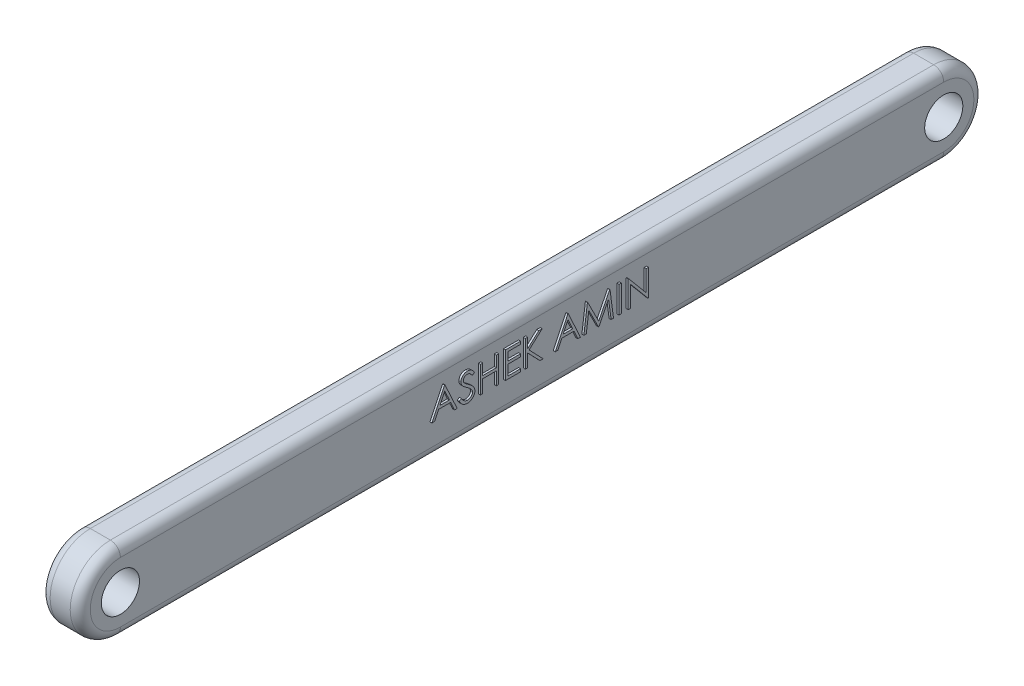
from build123d import *

# Parameters (mm, degrees)
SKETCH1_R           = 0.95
BOSS_EXTRUDE1_DEPTH = 1
FILLET1_R           = 0.5
SKETCH3_W           = 0.11872329
SKETCH3_H           = 1.322916667
BOSS_EXTRUDE3_DEPTH = 0.1


with BuildPart() as part:
    # Sketch1 → Boss-Extrude1 (new, symmetric)
    with BuildSketch(Plane(origin=(0, 0, 0), x_dir=(0, 0, -1), z_dir=(1, 0, 0))):
        with BuildLine():
            Line((-20.5, 2), (20.5, 2))
            ThreePointArc((20.5, 2), (22.5, 0), (20.5, -2))
            Line((20.5, -2), (-20.5, -2))
            ThreePointArc((-20.5, -2), (-22.5, 0), (-20.5, 2))
        make_face()
        with Locations((20.5, 0)):
            Circle(SKETCH1_R, mode=Mode.SUBTRACT)
        with Locations((-20.5, 0)):
            Circle(SKETCH1_R, mode=Mode.SUBTRACT)
    extrude(amount=BOSS_EXTRUDE1_DEPTH, both=True)

    # Fillet1
    fillet1_edges = [part.edges().sort_by_distance(p)[0] for p in [
        (1, 0, -22.5),
        (1, 2, 0),
        (1, 0, 22.5),
        (-1, 2, 0),
        (-1, 0, -22.5),
        (-1, -2, 0),
        (-1, 0, 22.5),
        (1, -2, 0),
    ]]
    fillet(fillet1_edges, radius=FILLET1_R)

    # Sketch3 → Boss-Extrude3 (add)
    # profile 1 of 9: a face of its own
    with BuildSketch(Plane(origin=(1, 0, 0), x_dir=(0, 0, -1), z_dir=(1, 0, 0))):
        Polygon((-4.439999829, 0.966036267), (-3.829422906, -0.3568804), (-3.958481483, -0.3568804), (-4.154056904, 0.067131352), (-4.753768526, 0.067131352), (-4.954909101, -0.3568804), (-5.084497692, -0.3568804), (-4.456960299, 0.966036267), align=None)
        Polygon((-4.449805101, 0.70818412), (-4.689371741, 0.202815113), (-4.216598637, 0.202815113), align=None, mode=Mode.SUBTRACT)
    # profile 2 of 9: a face of its own
    with BuildSketch(Plane(origin=(1, 0, 0), x_dir=(0, 0, -1), z_dir=(1, 0, 0))):
        with BuildLine():
            Line((-3.727660086, -0.101678326), (-3.615826986, -0.034631468))
            add(Edge.make_bspline(
                [(-3.615826986, -0.034631468), (-3.605425747, -0.052042709), (-3.585497376, -0.085401974), (-3.552253856, -0.130478674), (-3.517807786, -0.168791156), (-3.481904079, -0.20011654), (-3.44476189, -0.224779066), (-3.406138751, -0.24224241), (-3.366164817, -0.253134162), (-3.338960426, -0.254457112), (-3.325378936, -0.255117579)],
                knots=[0, 0, 0, 0, 1.272034388, 2.437168799, 3.508375237, 4.49857839, 5.41946034, 6.295179144, 7.148887113, 8, 8, 8, 8], degree=3))
            add(Edge.make_bspline(
                [(-3.325378936, -0.255117579), (-3.313780033, -0.254794533), (-3.290785181, -0.254154094), (-3.256932786, -0.248000339), (-3.224055736, -0.23854635), (-3.192831637, -0.22500689), (-3.163691331, -0.208625975), (-3.13813761, -0.188840366), (-3.11604637, -0.166688615), (-3.097975663, -0.141975529), (-3.084111483, -0.115397321), (-3.073455553, -0.08811653), (-3.067542087, -0.059704601), (-3.066651291, -0.040575051), (-3.066201752, -0.030921365)],
                knots=[0, 0, 0, 0, 1.095163259, 2.171163733, 3.241058638, 4.321873601, 5.38011039, 6.391990106, 7.366004449, 8.327778327, 9.272591725, 10.192022065, 11.087607919, 12, 12, 12, 12], degree=3))
            add(Edge.make_bspline(
                [(-3.066201752, -0.030921365), (-3.066759007, -0.019906818), (-3.067891823, 0.002484147), (-3.07746652, 0.035519135), (-3.092528586, 0.068211267), (-3.10642399, 0.088433472), (-3.113638067, 0.098932234)],
                knots=[0, 0, 0, 0, 0.938893495, 1.908633276, 2.914225137, 4, 4, 4, 4], degree=3))
            add(Edge.make_bspline(
                [(-3.113638067, 0.098932234), (-3.119561186, 0.106509456), (-3.131996034, 0.122416886), (-3.153373427, 0.146095293), (-3.178458238, 0.170519517), (-3.206392022, 0.196622196), (-3.238192326, 0.22318931), (-3.272863143, 0.251487736), (-3.311289661, 0.280441309), (-3.338239173, 0.299858915), (-3.352144678, 0.30987808)],
                knots=[0, 0, 0, 0, 0.722233717, 1.516239348, 2.393582979, 3.351407094, 4.387010283, 5.505090956, 6.712668013, 8, 8, 8, 8], degree=3))
            add(Edge.make_bspline(
                [(-3.352144678, 0.30987808), (-3.366063271, 0.319791862), (-3.392674563, 0.338746258), (-3.429889563, 0.366876865), (-3.463168273, 0.392595828), (-3.492362783, 0.416145261), (-3.517460249, 0.437528358), (-3.538658443, 0.456539782), (-3.555417362, 0.473693687), (-3.564736585, 0.484821813), (-3.568920686, 0.489818068)],
                knots=[0, 0, 0, 0, 1.452282411, 2.77665338, 3.964542531, 5.026858415, 5.96415736, 6.766646006, 7.446254459, 8, 8, 8, 8], degree=3))
            add(Edge.make_bspline(
                [(-3.568920686, 0.489818068), (-3.57476894, 0.497604769), (-3.586270315, 0.512918363), (-3.601452109, 0.536853651), (-3.6143559, 0.561355302), (-3.624471424, 0.586489156), (-3.632989578, 0.611902358), (-3.638718915, 0.637926489), (-3.642306437, 0.664444777), (-3.642673825, 0.682290356), (-3.642857735, 0.69122365)],
                knots=[0, 0, 0, 0, 1.068054152, 2.10047183, 3.106115577, 4.101338837, 5.06977816, 6.043150881, 7.020423561, 8, 8, 8, 8], degree=3))
            add(Edge.make_bspline(
                [(-3.642857735, 0.69122365), (-3.642364397, 0.705220023), (-3.641388266, 0.732913607), (-3.633133071, 0.773368712), (-3.620103138, 0.811992745), (-3.60184882, 0.848403318), (-3.578317023, 0.881652364), (-3.55108536, 0.912122343), (-3.518650661, 0.937737253), (-3.483063211, 0.960118001), (-3.444110356, 0.977635658), (-3.403292366, 0.990850076), (-3.360544366, 0.998337504), (-3.331590205, 0.999412001), (-3.316898701, 0.999957207)],
                knots=[0, 0, 0, 0, 1.005424448, 1.989358655, 2.955360095, 3.929531133, 4.905563448, 5.876582895, 6.856512386, 7.866279853, 8.892233794, 9.918561126, 10.94386622, 12, 12, 12, 12], degree=3))
            add(Edge.make_bspline(
                [(-3.316898701, 0.999957207), (-3.301309413, 0.999419516), (-3.270307295, 0.998350221), (-3.224704764, 0.98905294), (-3.180798779, 0.973669055), (-3.145479449, 0.956210842), (-3.117837007, 0.938774266), (-3.096756242, 0.922891772), (-3.075393991, 0.904607133), (-3.053577941, 0.883871644), (-3.031677751, 0.860495045), (-3.009368291, 0.834637433), (-2.986597392, 0.80645683), (-2.9719486, 0.786339236), (-2.964438932, 0.776026)],
                knots=[0, 0, 0, 0, 1.286793592, 2.559021753, 3.825965368, 5.121522368, 5.803751409, 6.523245864, 7.299691795, 8.125521123, 9.008227632, 9.944561021, 10.946284179, 12, 12, 12, 12], degree=3))
            Line((-2.964438932, 0.776026), (-3.071766906, 0.694668745))
            add(Edge.make_bspline(
                [(-3.071766906, 0.694668745), (-3.078247661, 0.703017745), (-3.090728078, 0.719095965), (-3.109675831, 0.741612504), (-3.127534695, 0.762180637), (-3.145129637, 0.78004573), (-3.161531397, 0.79618612), (-3.177450636, 0.810004838), (-3.192658263, 0.82163728), (-3.211828047, 0.834051364), (-3.235911828, 0.846356947), (-3.266144078, 0.856769842), (-3.2977377, 0.863027262), (-3.319255745, 0.863854609), (-3.330149068, 0.864273446)],
                knots=[0, 0, 0, 0, 1.181633172, 2.275549214, 3.290209073, 4.226197932, 5.078386478, 5.862611352, 6.581680152, 7.217281963, 8.414376989, 9.595101626, 10.782541182, 12, 12, 12, 12], degree=3))
            add(Edge.make_bspline(
                [(-3.330149068, 0.864273446), (-3.343815372, 0.863815453), (-3.370169554, 0.862932255), (-3.407585506, 0.853286308), (-3.441260888, 0.838098522), (-3.470195935, 0.816812801), (-3.494286995, 0.791593854), (-3.511713761, 0.762573275), (-3.522202662, 0.730527545), (-3.523482595, 0.708173407), (-3.524134444, 0.696788804)],
                knots=[0, 0, 0, 0, 1.14458467, 2.207223713, 3.21896685, 4.227309161, 5.202851033, 6.127160689, 7.046193047, 8, 8, 8, 8], degree=3))
            add(Edge.make_bspline(
                [(-3.524134444, 0.696788804), (-3.523985852, 0.689701192), (-3.523688424, 0.675514377), (-3.519540212, 0.65455506), (-3.514211001, 0.633648691), (-3.505766018, 0.612889262), (-3.494107228, 0.591913716), (-3.478797236, 0.570360857), (-3.459515419, 0.548040717), (-3.444745238, 0.533523644), (-3.436947028, 0.525859067)],
                knots=[0, 0, 0, 0, 0.858281714, 1.717966888, 2.583508476, 3.4729293, 4.427298488, 5.488583878, 6.674047936, 8, 8, 8, 8], degree=3))
            add(Edge.make_bspline(
                [(-3.436947028, 0.525859067), (-3.434051212, 0.523274834), (-3.427171415, 0.517135288), (-3.414593907, 0.507084039), (-3.397984576, 0.494685372), (-3.377777137, 0.479344333), (-3.353598997, 0.461548661), (-3.325447498, 0.441525897), (-3.293636442, 0.418626036), (-3.27106298, 0.402615894), (-3.259127099, 0.394150416)],
                knots=[0, 0, 0, 0, 0.420754252, 0.999615792, 1.744751191, 2.668019286, 3.750313428, 4.999500688, 6.413464383, 8, 8, 8, 8], degree=3))
            add(Edge.make_bspline(
                [(-3.259127099, 0.394150416), (-3.244769329, 0.38370264), (-3.216967495, 0.363471971), (-3.177409422, 0.333076758), (-3.141541822, 0.303349774), (-3.109238766, 0.274480857), (-3.080181125, 0.246688989), (-3.054691272, 0.219639811), (-3.032509482, 0.193527109), (-3.008629242, 0.160048784), (-2.984227923, 0.118932124), (-2.963272353, 0.068556124), (-2.95005893, 0.0179843), (-2.948331006, -0.016005903), (-2.947478462, -0.032776417)],
                knots=[0, 0, 0, 0, 1.163667725, 2.253281268, 3.268753668, 4.215851969, 5.092017293, 5.902905408, 6.650798638, 7.335211899, 8.59617414, 9.77448103, 10.901945474, 12, 12, 12, 12], degree=3))
            add(Edge.make_bspline(
                [(-2.947478462, -0.032776417), (-2.947726844, -0.044636692), (-2.948218786, -0.068126923), (-2.953873655, -0.102619169), (-2.962158767, -0.136119528), (-2.974646054, -0.168213907), (-2.989887248, -0.199489457), (-3.009226872, -0.229125776), (-3.031643764, -0.25777879), (-3.057358908, -0.284684455), (-3.085497686, -0.309383761), (-3.115238249, -0.331355162), (-3.146629275, -0.349675035), (-3.179500472, -0.364624311), (-3.213859391, -0.376316444), (-3.249694476, -0.384787975), (-3.287064797, -0.389987306), (-3.312464979, -0.390526966), (-3.325378936, -0.39080134)],
                knots=[0, 0, 0, 0, 0.983748083, 1.948392443, 2.894712957, 3.844097841, 4.80183111, 5.778335162, 6.776009319, 7.81870978, 8.863265674, 9.881300176, 10.883814829, 11.87499822, 12.874611388, 13.892143829, 14.928324115, 16, 16, 16, 16], degree=3))
            add(Edge.make_bspline(
                [(-3.325378936, -0.39080134), (-3.335370866, -0.390608126), (-3.355228888, -0.39022413), (-3.384601222, -0.38682942), (-3.413380174, -0.382026437), (-3.44120462, -0.374401119), (-3.468433046, -0.365149404), (-3.494947031, -0.353757832), (-3.520759423, -0.34010639), (-3.546014879, -0.324497854), (-3.570649165, -0.306333171), (-3.594431226, -0.285176522), (-3.618141364, -0.261611405), (-3.641079755, -0.234997889), (-3.663710378, -0.205765935), (-3.685587039, -0.173642047), (-3.707162569, -0.138801202), (-3.720699963, -0.114283744), (-3.727660086, -0.101678326)],
                knots=[0, 0, 0, 0, 0.915332311, 1.819136955, 2.706846663, 3.586547465, 4.459518054, 5.340707479, 6.227863349, 7.133153174, 8.059268498, 9.028702269, 10.047606654, 11.120612155, 12.245963614, 13.433783089, 14.680604001, 16, 16, 16, 16], degree=3))
        make_face()
    # profile 3 of 9: a face of its own
    with BuildSketch(Plane(origin=(1, 0, 0), x_dir=(0, 0, -1), z_dir=(1, 0, 0))):
        Polygon((-2.67611094, 0.966036267), (-2.55738765, 0.966036267), (-2.55738765, 0.423301224), (-1.878968846, 0.423301224), (-1.878968846, 0.966036267), (-1.760245556, 0.966036267), (-1.760245556, -0.3568804), (-1.878968846, -0.3568804), (-1.878968846, 0.287617463), (-2.55738765, 0.287617463), (-2.55738765, -0.3568804), (-2.67611094, -0.3568804), align=None)
    # profile 4 of 9: a face of its own
    with BuildSketch(Plane(origin=(1, 0, 0), x_dir=(0, 0, -1), z_dir=(1, 0, 0))):
        Polygon((-1.421036154, 0.966036267), (-0.67477547, 0.966036267), (-0.67477547, 0.830352506), (-1.302312863, 0.830352506), (-1.302312863, 0.423301224), (-0.67477547, 0.423301224), (-0.67477547, 0.287617463), (-1.302312863, 0.287617463), (-1.302312863, -0.221196639), (-0.67477547, -0.221196639), (-0.67477547, -0.3568804), (-1.421036154, -0.3568804), align=None)
    # profile 5 of 9: a face of its own
    with BuildSketch(Plane(origin=(1, 0, 0), x_dir=(0, 0, -1), z_dir=(1, 0, 0))):
        Polygon((-0.437328889, 0.966036267), (-0.318605598, 0.966036267), (-0.318605598, 0.462257304), (0.232874687, 0.966036267), (0.40221438, 0.966036267), (-0.247848637, 0.372419814), (0.453095791, -0.3568804), (0.294886406, -0.3568804), (-0.318605598, 0.281522295), (-0.318605598, -0.3568804), (-0.437328889, -0.3568804), align=None)
    # profile 6 of 9: a face of its own
    with BuildSketch(Plane(origin=(1, 0, 0), x_dir=(0, 0, -1), z_dir=(1, 0, 0))):
        Polygon((1.699690342, 0.966036267), (2.310267265, -0.3568804), (2.181208688, -0.3568804), (1.985633267, 0.067131352), (1.385921645, 0.067131352), (1.18478107, -0.3568804), (1.055192479, -0.3568804), (1.682729872, 0.966036267), align=None)
        Polygon((1.68988507, 0.70818412), (1.45031843, 0.202815113), (1.923091534, 0.202815113), align=None, mode=Mode.SUBTRACT)
    # profile 7 of 9: a face of its own
    with BuildSketch(Plane(origin=(1, 0, 0), x_dir=(0, 0, -1), z_dir=(1, 0, 0))):
        Polygon((2.479871966, -0.3568804), (2.654511806, 0.966036267), (2.671472276, 0.966036267), (3.217652414, -0.119433819), (3.762507516, 0.966036267), (3.779732993, 0.966036267), (3.955432863, -0.3568804), (3.836179558, -0.3568804), (3.709506047, 0.595025984), (3.231962811, -0.3568804), (3.205197069, -0.3568804), (2.725798782, 0.597146043), (2.599390278, -0.3568804), align=None)
    # profile 8 of 9: a face of its own
    with BuildSketch(Plane(origin=(1, 0, 0), x_dir=(0, 0, -1), z_dir=(1, 0, 0))):
        with Locations((4.28616203, 0.304577934)):
            Rectangle(SKETCH3_W, SKETCH3_H)
    # profile 9 of 9: a face of its own
    with BuildSketch(Plane(origin=(1, 0, 0), x_dir=(0, 0, -1), z_dir=(1, 0, 0))):
        Polygon((4.684733077, -0.3568804), (4.684733077, 0.966036267), (4.709643767, 0.966036267), (5.583637991, -0.075177592), (5.583637991, 0.966036267), (5.702361282, 0.966036267), (5.702361282, -0.3568804), (5.675330533, -0.3568804), (4.803456367, 0.681948393), (4.803456367, -0.3568804), align=None)
    extrude(amount=BOSS_EXTRUDE3_DEPTH)


solid = part.part
